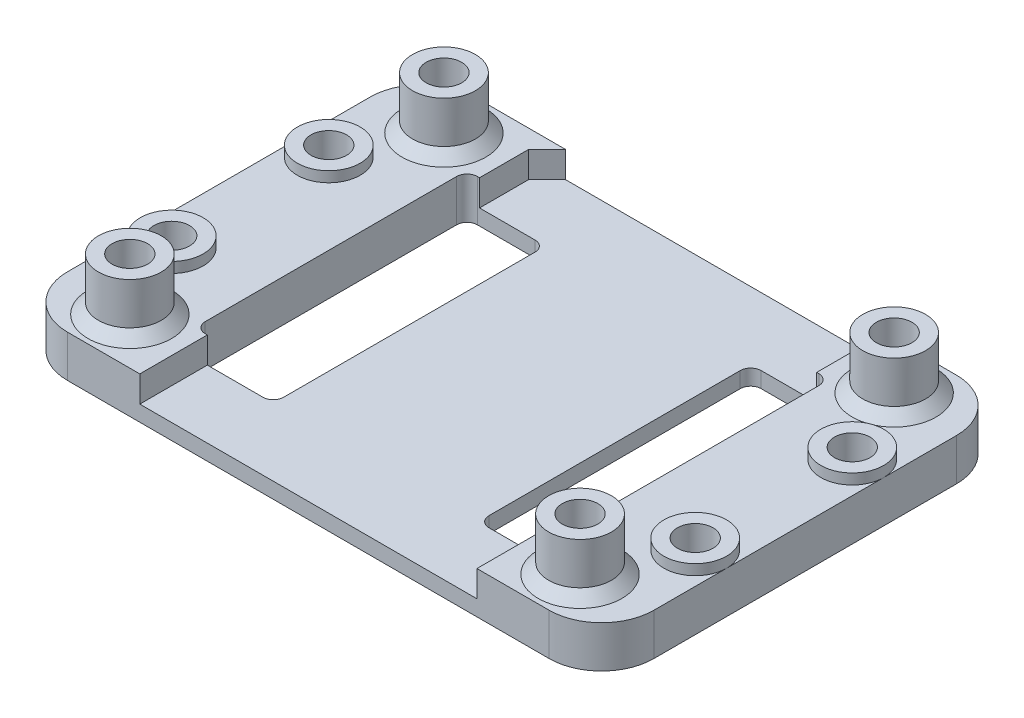
from build123d import *

# Parameters (mm, degrees)
SKETCH2_R               = 3
SKETCH2_R_2             = 1.7
BOSS_EXTRUDE1_DEPTH     = 5
BOSS_EXTRUDE1_2_DEPTH   = 5
BOSS_EXTRUDE1_3_DEPTH   = 5
BOSS_EXTRUDE1_4_DEPTH   = 5
SKETCH3_W               = 56
SKETCH3_H               = 38.9
SKETCH3_R               = 1.7
BOSS_EXTRUDE2_DEPTH     = 4
FILLET1_R               = 5
CUT_EXTRUDE2_START      = 4
CUT_EXTRUDE2_DEPTH      = 2.5
CUT_EXTRUDE3_DEPTH      = 2.5
SKETCH5_R               = 3
SKETCH5_R_2             = 1.7
BOSS_EXTRUDE3_DEPTH     = 5
SKETCH5_2_R             = 1.7
CUT_EXTRUDE4_DEPTH      = 35.45725613
CUT_EXTRUDE5_DEPTH      = 2.5
CHAMFER1_SIZE           = 1
CHAMFER2_SIZE           = 1
CUT_EXTRUDE6_DEPTH      = 35.907771341
CUT_EXTRUDE6_DEPTH_BACK = 35.907771341
SKETCH7_W               = 7.5
SKETCH7_H               = 26
FILLET3_R               = 1


with BuildPart() as part:
    # Sketch2 → Boss-Extrude1 (new body)
    with BuildSketch(Plane(origin=(0, 0, 0), x_dir=(1, 0, 0), z_dir=(0, 1, 0))):
        with Locations(Location((-25, 7.5, 0), (0, 0, 270))):
            Circle(SKETCH2_R)
        with Locations(Location((-25, 7.5, 0), (0, 0, 270))):
            Circle(SKETCH2_R_2, mode=Mode.SUBTRACT)
    extrude(amount=BOSS_EXTRUDE1_DEPTH)



with BuildPart() as body_2:
    # Sketch2 → Boss-Extrude1 2 (new body)
    with BuildSketch(Plane(origin=(0, 0, 0), x_dir=(1, 0, 0), z_dir=(0, 1, 0))):
        with Locations(Location((-25, -7.5, 0), (0, 0, 270))):
            Circle(SKETCH2_R)
        with Locations(Location((-25, -7.5, 0), (0, 0, 270))):
            Circle(SKETCH2_R_2, mode=Mode.SUBTRACT)
    extrude(amount=BOSS_EXTRUDE1_2_DEPTH)


with BuildPart() as body_3:
    # Sketch2 → Boss-Extrude1 3 (new body)
    with BuildSketch(Plane(origin=(0, 0, 0), x_dir=(1, 0, 0), z_dir=(0, 1, 0))):
        with Locations(Location((25, -7.5, 0), (0, 0, 270))):
            Circle(SKETCH2_R)
        with Locations(Location((25, -7.5, 0), (0, 0, 270))):
            Circle(SKETCH2_R_2, mode=Mode.SUBTRACT)
    extrude(amount=BOSS_EXTRUDE1_3_DEPTH)


with BuildPart() as body_4:
    # Sketch2 → Boss-Extrude1 4 (new body)
    with BuildSketch(Plane(origin=(0, 0, 0), x_dir=(1, 0, 0), z_dir=(0, 1, 0))):
        with Locations(Location((25, 7.5, 0), (0, 0, 270))):
            Circle(SKETCH2_R)
        with Locations(Location((25, 7.5, 0), (0, 0, 270))):
            Circle(SKETCH2_R_2, mode=Mode.SUBTRACT)
    extrude(amount=BOSS_EXTRUDE1_4_DEPTH)


with BuildPart() as part_1:
    add(part.part)

    add(body_2.part)  # Boss-Extrude2 merges body 2

    add(body_3.part)  # Boss-Extrude2 merges body 3

    add(body_4.part)  # Boss-Extrude2 merges body 4
    # Sketch3 → Boss-Extrude2 (add)
    with BuildSketch(Plane(origin=(0, 0, 0), x_dir=(1, 0, 0), z_dir=(0, 1, 0))):
        Rectangle(SKETCH3_W, SKETCH3_H)
        with Locations(Location((-25, 7.5, 0), (0, 0, 270))):
            Circle(SKETCH3_R, mode=Mode.SUBTRACT)
        with Locations(Location((25, 7.5, 0), (0, 0, 270))):
            Circle(SKETCH3_R, mode=Mode.SUBTRACT)
        with Locations(Location((25, -7.5, 0), (0, 0, 270))):
            Circle(SKETCH3_R, mode=Mode.SUBTRACT)
        with Locations(Location((-25, -7.5, 0), (0, 0, 270))):
            Circle(SKETCH3_R, mode=Mode.SUBTRACT)
    extrude(amount=BOSS_EXTRUDE2_DEPTH)

    # Fillet1
    fillet1_edges = [part_1.edges().sort_by_distance(p)[0] for p in [
        (28, 2, 19.45),
        (28, 2, -19.45),
        (-28, 2, -19.45),
        (-28, 2, 19.45),
    ]]
    fillet(fillet1_edges, radius=FILLET1_R)

    # Sketch1 → Cut-Extrude2 (cut)
    with BuildSketch(Plane(origin=(0, 0, 0), x_dir=(1, 0, 0), z_dir=(0, 1, 0)).offset(CUT_EXTRUDE2_START)):
        Polygon((13.620101013, 19.45), (15.6, 17.470101013), (15.6, -19.45), (-15.6, -19.45), (-15.6, 17.470101013), (-13.620101013, 19.45), align=None)
    extrude(amount=-CUT_EXTRUDE2_DEPTH, mode=Mode.SUBTRACT)

    # Sketch4 → Cut-Extrude3 (cut)
    with BuildSketch(Plane(origin=(0, 4, 0), x_dir=(1, 0, 0), z_dir=(0, 1, 0))):
        Polygon((-16.1, -19.95), (16.1, -19.95), (16.1, 17.677207794), (13.827207794, 19.95), (-13.827207794, 19.95), (-16.1, 17.677207794), align=None)
    extrude(amount=-CUT_EXTRUDE3_DEPTH, mode=Mode.SUBTRACT)

    # Sketch5 → Boss-Extrude3 (add)
    # profile 1 of 4: a face of its own
    with BuildSketch(Plane(origin=(0, 4, 0), x_dir=(1, 0, 0), z_dir=(0, 1, 0))):
        with Locations(Location((-21.5, 15, 0), (0, 0, 90))):
            Circle(SKETCH5_R)
        with Locations(Location((-21.5, 15, 0), (0, 0, 270))):
            Circle(SKETCH5_R_2, mode=Mode.SUBTRACT)
    # profile 2 of 4: a face of its own
    with BuildSketch(Plane(origin=(0, 4, 0), x_dir=(1, 0, 0), z_dir=(0, 1, 0))):
        with Locations(Location((21.5, 15, 0), (0, 0, 90))):
            Circle(SKETCH5_R)
        with Locations(Location((21.5, 15, 0), (0, 0, 270))):
            Circle(SKETCH5_R_2, mode=Mode.SUBTRACT)
    # profile 3 of 4: a face of its own
    with BuildSketch(Plane(origin=(0, 4, 0), x_dir=(1, 0, 0), z_dir=(0, 1, 0))):
        with Locations(Location((21.5, -15, 0), (0, 0, 90))):
            Circle(SKETCH5_R)
        with Locations(Location((21.5, -15, 0), (0, 0, 270))):
            Circle(SKETCH5_R_2, mode=Mode.SUBTRACT)
    # profile 4 of 4: a face of its own
    with BuildSketch(Plane(origin=(0, 4, 0), x_dir=(1, 0, 0), z_dir=(0, 1, 0))):
        with Locations(Location((-21.5, -15, 0), (0, 0, 90))):
            Circle(SKETCH5_R)
        with Locations(Location((-21.5, -15, 0), (0, 0, 270))):
            Circle(SKETCH5_R_2, mode=Mode.SUBTRACT)
    extrude(amount=BOSS_EXTRUDE3_DEPTH)

    # Sketch5<2> → Cut-Extrude4 (cut, through all)
    with BuildSketch(Plane(origin=(0, 4, 0), x_dir=(1, 0, 0), z_dir=(0, 1, 0))):
        with Locations(Location((-21.5, 15, 0), (0, 0, 270))):
            Circle(SKETCH5_2_R)
        with Locations(Location((21.5, 15, 0), (0, 0, 270))):
            Circle(SKETCH5_2_R)
        with Locations(Location((21.5, -15, 0), (0, 0, 270))):
            Circle(SKETCH5_2_R)
        with Locations(Location((-21.5, -15, 0), (0, 0, 270))):
            Circle(SKETCH5_2_R)
    extrude(amount=-CUT_EXTRUDE4_DEPTH, mode=Mode.SUBTRACT)

    # Sketch6 → Cut-Extrude5 (cut)
    with BuildSketch(Plane.XZ):
        Polygon((-19.970021787, 12.35), (-18.440043573, 15), (-19.970021787, 17.65), (-23.029978213, 17.65), (-24.559956427, 15), (-23.029978213, 12.35), align=None)
        Polygon((23.029978213, 12.35), (24.559956427, 15), (23.029978213, 17.65), (19.970021787, 17.65), (18.440043573, 15), (19.970021787, 12.35), align=None)
        Polygon((24.559956427, -15), (23.029978213, -12.35), (19.970021787, -12.35), (18.440043573, -15), (19.970021787, -17.65), (23.029978213, -17.65), align=None)
        Polygon((-18.440043573, -15), (-19.970021787, -12.35), (-23.029978213, -12.35), (-24.559956427, -15), (-23.029978213, -17.65), (-19.970021787, -17.65), align=None)
    extrude(amount=-CUT_EXTRUDE5_DEPTH, mode=Mode.SUBTRACT)

    # Chamfer1
    chamfer1_edges = [part_1.edges().sort_by_distance(p)[0] for p in [
        (-21.5, 4, 18),
    ]]
    chamfer(chamfer1_edges, length=CHAMFER1_SIZE)

    # Chamfer2
    chamfer2_edges = [part_1.edges().sort_by_distance(p)[0] for p in [
        (-21.5, 4, -12),
        (21.5, 4, -12),
        (21.5, 4, 18),
    ]]
    chamfer(chamfer2_edges, length=CHAMFER2_SIZE)

    # Sketch7 → Cut-Extrude6 (cut, two sides: drawn at the far end of the back side and taken through both)
    with BuildSketch(Plane(origin=(0, 1.5, 0), x_dir=(1, 0, 0), z_dir=(0, 1, 0)).offset(-CUT_EXTRUDE6_DEPTH_BACK)):
        with Locations((-13.55, 0)):
            Rectangle(SKETCH7_W, SKETCH7_H)
        with Locations((13.55, 0)):
            Rectangle(SKETCH7_W, SKETCH7_H)
    extrude(amount=CUT_EXTRUDE6_DEPTH + CUT_EXTRUDE6_DEPTH_BACK, mode=Mode.SUBTRACT)

    # Fillet3
    fillet3_edges = [part_1.edges().sort_by_distance(p)[0] for p in [
        (-17.3, 2, 13),
        (-9.8, 0.75, -13),
        (-17.3, 2, -13),
        (-9.8, 0.75, 13),
        (17.3, 2, -13),
        (9.8, 0.75, 13),
        (17.3, 2, 13),
        (9.8, 0.75, -13),
    ]]
    fillet(fillet3_edges, radius=FILLET3_R)


solid = part_1.part
